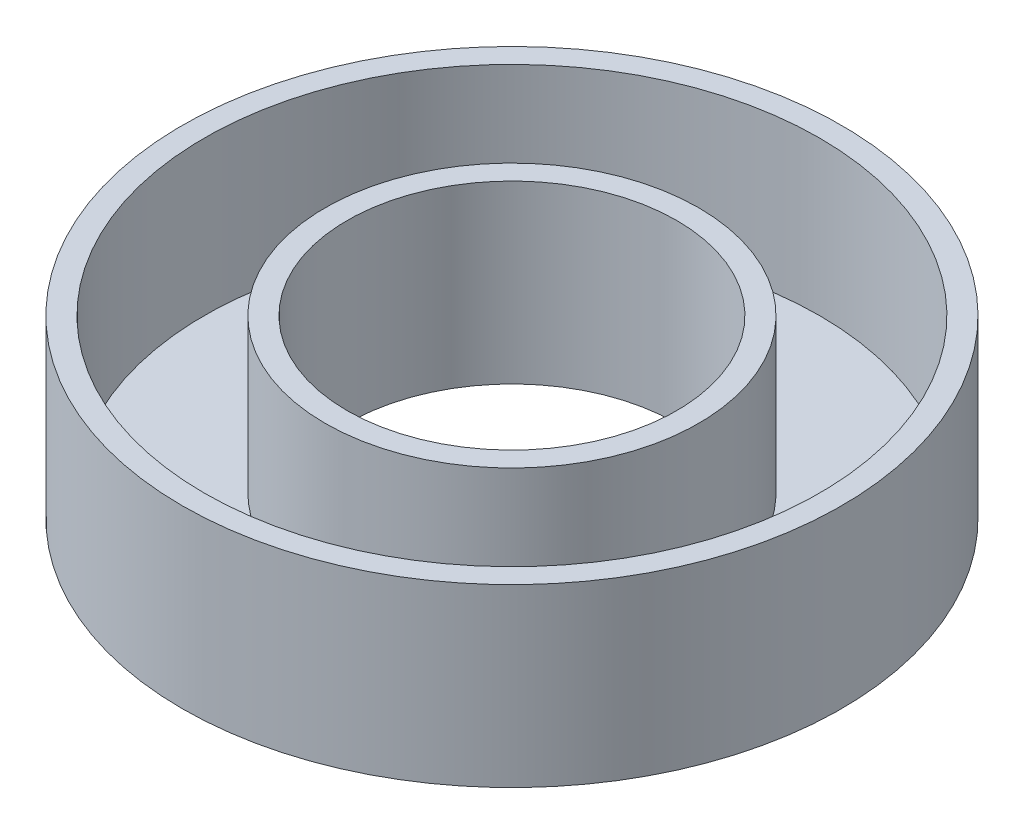
from build123d import *

# Parameters (mm, degrees)
SKETCH1_R            = 15
MAIN_EXTRUSION_DEPTH = 8
SKETCH2_R            = 7.5
ID_BORE_DEPTH        = 20
SKETCH3_R            = 14
SKETCH3_R_2          = 8.5
SEAL_RECESS_DEPTH    = 7


with BuildPart() as part:
    # Sketch1 → main extrusion (new body)
    with BuildSketch(Plane(origin=(0, 0, 0), x_dir=(1, 0, 0), z_dir=(0, 1, 0))):
        with Locations(Location((0, 0, 0), (0, 0, 270))):
            Circle(SKETCH1_R)
    extrude(amount=MAIN_EXTRUSION_DEPTH)

    # Sketch2 → ID bore (cut)
    with BuildSketch(Plane(origin=(0, 8, 0), x_dir=(1, 0, 0), z_dir=(0, 1, 0))):
        with Locations(Location((0, 0, 0), (0, 0, 270))):
            Circle(SKETCH2_R)
    extrude(amount=-ID_BORE_DEPTH, mode=Mode.SUBTRACT)

    # Sketch3 → seal recess (cut)
    with BuildSketch(Plane(origin=(0, 8, 0), x_dir=(1, 0, 0), z_dir=(0, 1, 0))):
        with Locations(Location((0, 0, 0), (0, 0, 270))):
            Circle(SKETCH3_R)
        with Locations(Location((0, 0, 0), (0, 0, 270))):
            Circle(SKETCH3_R_2, mode=Mode.SUBTRACT)
    extrude(amount=-SEAL_RECESS_DEPTH, mode=Mode.SUBTRACT)


solid = part.part
